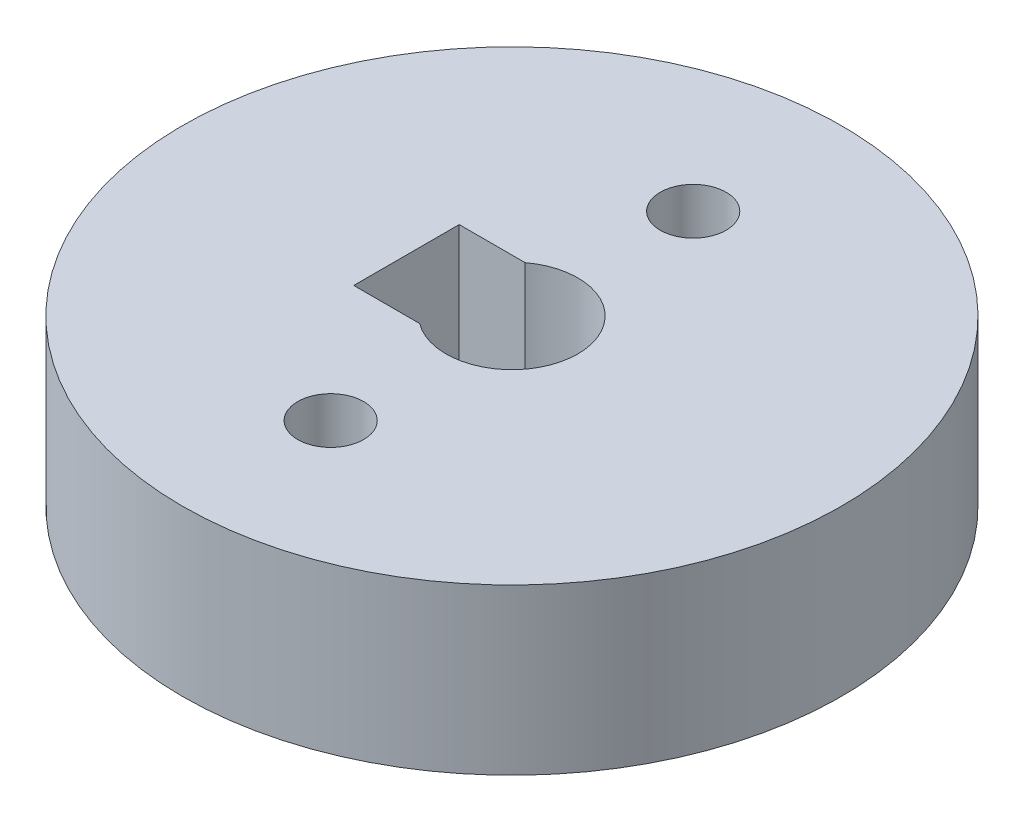
from build123d import *

# Parameters (mm, degrees)
SKETCH1_R        = 10
EXTRUSION1_DEPTH = 5
HOLE1_D          = 2


with BuildPart() as part:
    # Sketch1 → Extrusion1 (new body)
    with BuildSketch(Plane(origin=(0, 0, 0), x_dir=(-1, 0, 0), z_dir=(0, 1, 0))):
        with Locations(Location((0, 0, 0), (0, 0, 90))):
            Circle(SKETCH1_R)
        with BuildLine():
            ThreePointArc((1.2, 1.6), (-2, 0), (1.2, -1.6))
            Line((1.2, -1.6), (3.2, -1.6))
            Line((3.2, -1.6), (3.2, 1.6))
            Line((3.2, 1.6), (1.2, 1.6))
        make_face(mode=Mode.SUBTRACT)
    extrude(amount=EXTRUSION1_DEPTH)

    # Hole1 (through all)
    with Locations(Plane(origin=(0, 5, 0), x_dir=(1, 0, 0), z_dir=(0, 1, 0))):
        with Locations((0, -5.5), (0, 5.5)):
            Hole(HOLE1_D / 2)


solid = part.part
